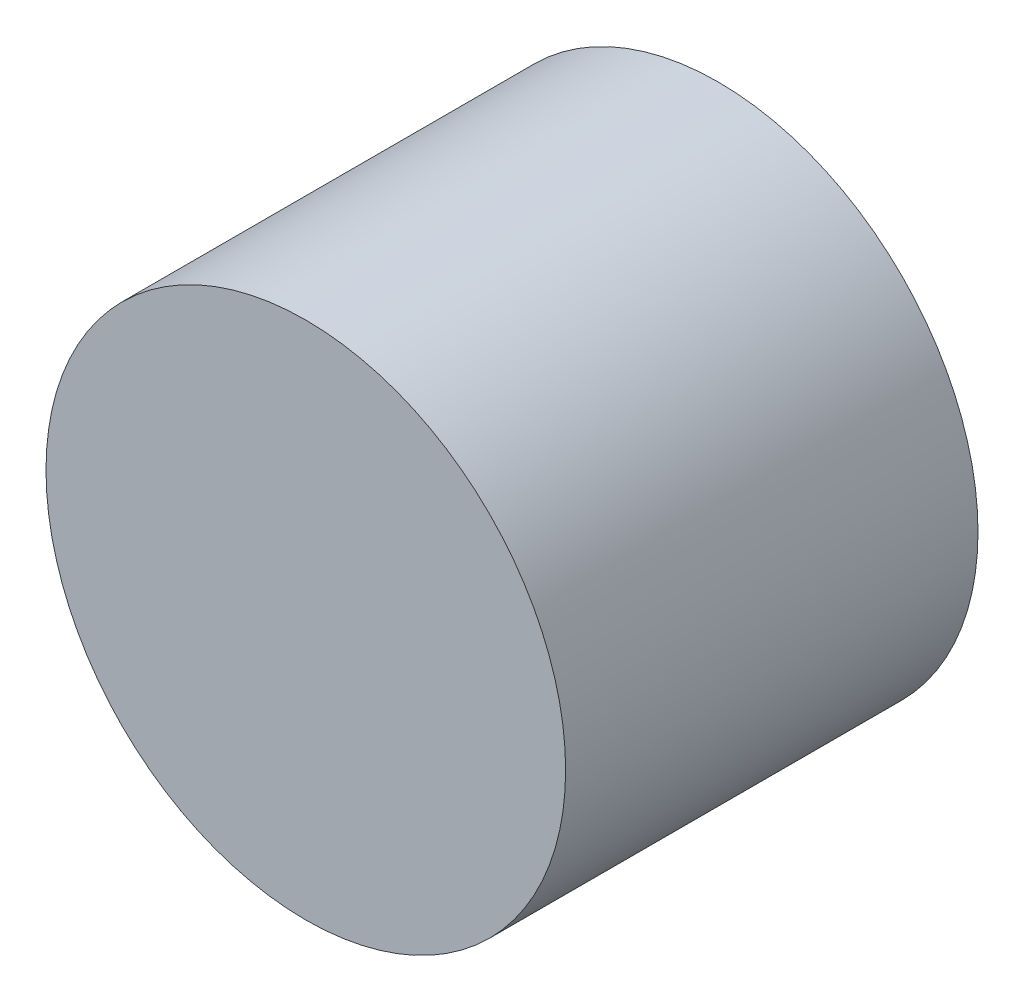
from build123d import *

# Parameters (mm, degrees)
CURVESKETCH_R   = 7.391
CURVEBOSS_DEPTH = 11.731


with BuildPart() as part:
    # CurveSketch → CurveBoss (new body)
    with BuildSketch(Plane.XY):
        with Locations((-3.719, 5.173)):
            Circle(CURVESKETCH_R)
    extrude(amount=CURVEBOSS_DEPTH)


solid = part.part
